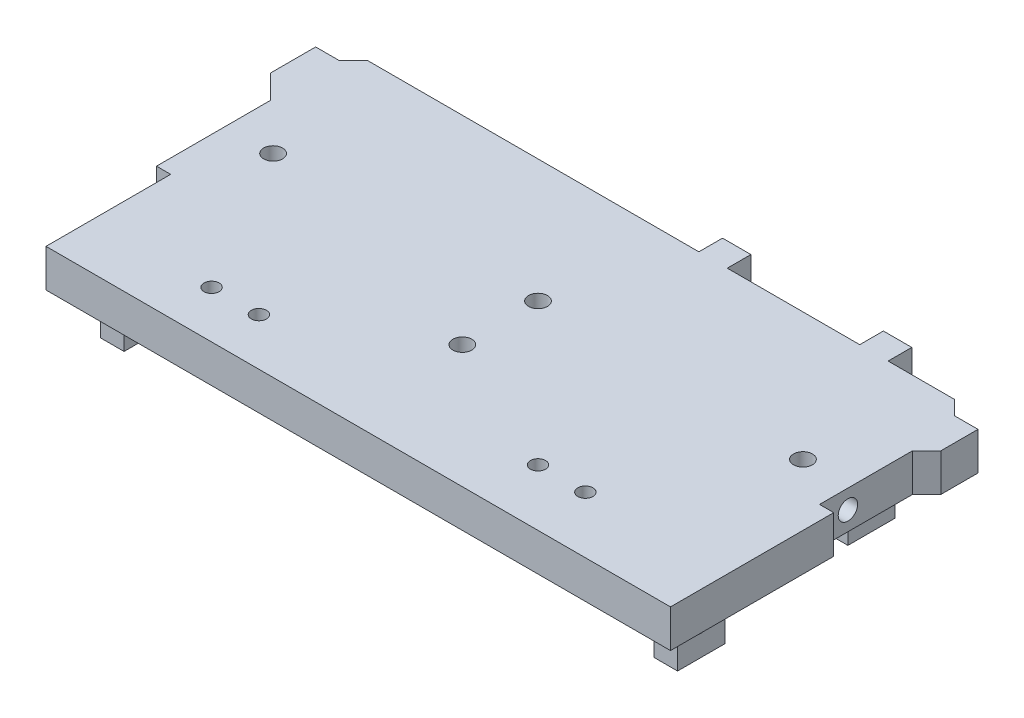
from build123d import *

# Parameters (mm, degrees)
CROQUIS1_W                 = 132
CROQUIS1_H                 = 68
SALIENTE_EXTRUIR1_DEPTH    = 8
CORTAR_EXTRUIR1_DEPTH      = 8
CROQUIS3_W                 = 6
CROQUIS3_H                 = 5
SALIENTE_EXTRUIR2_DEPTH    = 8
CROQUIS4_R                 = 2
CROQUIS4_R_2               = 1.6
CORTAR_EXTRUIR2_DEPTH      = 85.029980381
CROQUIS5_R                 = 2.05
CORTAR_EXTRUIR3_DEPTH      = 6
CROQUIS6_W                 = 5
CROQUIS6_H                 = 10
SALIENTE_EXTRUIR3_DEPTH    = 10
CORTAR_EXTRUIR4_DEPTH      = 136.614342899
CORTAR_EXTRUIR4_DEPTH_BACK = 136.614342899
CROQUIS7_R                 = 1.55


with BuildPart() as part:
    # Croquis1 → Saliente-Extruir1 (new body)
    with BuildSketch(Plane(origin=(0, 0, 0), x_dir=(1, 0, 0), z_dir=(0, 1, 0))):
        Rectangle(CROQUIS1_W, CROQUIS1_H)
    extrude(amount=SALIENTE_EXTRUIR1_DEPTH)

    # Croquis2 → Cortar-Extruir1 (cut)
    with BuildSketch(Plane(origin=(0, 8, 0), x_dir=(1, 0, 0), z_dir=(0, 1, 0))):
        Polygon((61, 31.000254068), (66, 31.000254068), (66, 34), (58.000254068, 34), align=None)
        Polygon((66.000254073, 23.155254073), (66, 0.506), (63, 0.506), (63, 20.155), align=None)
    extrude(amount=-CORTAR_EXTRUIR1_DEPTH, mode=Mode.SUBTRACT)

    # Croquis3 → Saliente-Extruir2 (add)
    with BuildSketch(Plane(origin=(0, 8, 0), x_dir=(1, 0, 0), z_dir=(0, 1, 0))):
        with Locations((41.000254068, 36.5)):
            Rectangle(CROQUIS3_W, CROQUIS3_H)
        with Locations((7.000254068, 36.5)):
            Rectangle(CROQUIS3_W, CROQUIS3_H)
        Polygon((-66, 34), (-69.000254073, 30.999745927), (-74.000254073, 30.999745927), (-74.000254073, 21.426745927), (-69.000302023, 16.426793878), (-69.000302023, -7.645206122), (-66, -7.645206122), align=None)
    extrude(amount=-SALIENTE_EXTRUIR2_DEPTH)

    # Croquis4 → Cortar-Extruir2 (cut, through all)
    with BuildSketch(Plane(origin=(0, 8, 0), x_dir=(1, 0, 0), z_dir=(0, 1, 0))):
        with Locations(Location((-59.000302023, 7, 0), (0, 0, 270))):
            Circle(CROQUIS4_R)
        with Locations(Location((-41, -24, 0), (0, 0, 270))):
            Circle(CROQUIS4_R_2)
        with Locations(Location((-31, -24, 0), (0, 0, 270))):
            Circle(CROQUIS4_R_2)
        with Locations(Location((-4.000302023, 8, 0), (0, 0, 270))):
            Circle(CROQUIS4_R)
        with Locations(Location((-4, -7.999999997, 0), (0, 0, 270))):
            Circle(CROQUIS4_R)
        with Locations(Location((26, -22, 0), (0, 0, 270))):
            Circle(CROQUIS4_R_2)
        with Locations(Location((36, -22, 0), (0, 0, 270))):
            Circle(CROQUIS4_R_2)
        with Locations(Location((53, 7, 0), (0, 0, 270))):
            Circle(CROQUIS4_R)
    extrude(amount=-CORTAR_EXTRUIR2_DEPTH, mode=Mode.SUBTRACT)

    # Croquis5 → Cortar-Extruir3 (cut)
    with BuildSketch(Plane(origin=(63, 0, 0), x_dir=(0, 0, -1), z_dir=(1, 0, 0))):
        with Locations((6.506, 4)):
            Circle(CROQUIS5_R)
    extrude(amount=-CORTAR_EXTRUIR3_DEPTH, mode=Mode.SUBTRACT)

    # Croquis6 → Saliente-Extruir3 (add)
    with BuildSketch(Plane.XZ):
        with Locations((-59.000254073, -19)):
            Rectangle(CROQUIS6_W, CROQUIS6_H)
        with Locations((-59.000254073, 22)):
            Rectangle(CROQUIS6_W, CROQUIS6_H)
        with Locations((57.999745927, 22)):
            Rectangle(CROQUIS6_W, CROQUIS6_H)
        with Locations((52.999745927, -19)):
            Rectangle(CROQUIS6_W, CROQUIS6_H)
    extrude(amount=SALIENTE_EXTRUIR3_DEPTH)

    # Croquis7 → Cortar-Extruir4 (cut, two sides: drawn at the far end of the back side and taken through both)
    with BuildSketch(Plane(origin=(55.499745927, 0, 0), x_dir=(0, 0, -1), z_dir=(1, 0, 0)).offset(-CORTAR_EXTRUIR4_DEPTH_BACK)):
        with Locations((19, -4)):
            Circle(CROQUIS7_R)
        with Locations((-22, -4)):
            Circle(CROQUIS7_R)
    extrude(amount=CORTAR_EXTRUIR4_DEPTH + CORTAR_EXTRUIR4_DEPTH_BACK, mode=Mode.SUBTRACT)


solid = part.part
